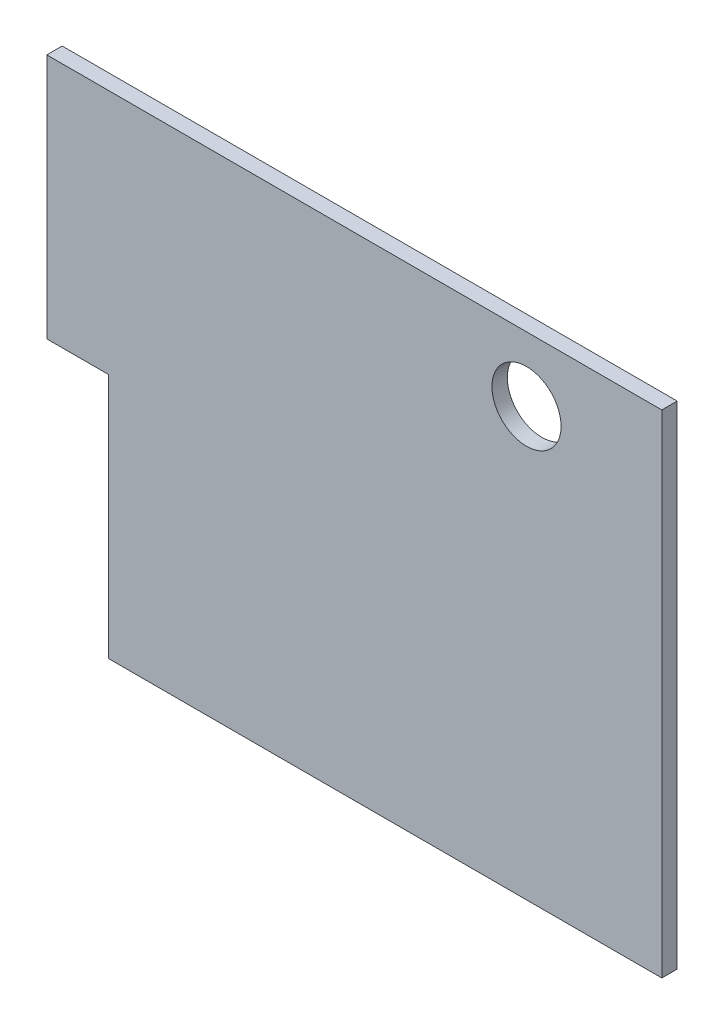
from build123d import *

# Parameters (mm, degrees)
SKETCH1_W           = 254
SKETCH1_H           = 203.2
BOSS_EXTRUDE1_DEPTH = 6.35
SKETCH2_R           = 14.2748
SKETCH2_W           = 25.4
SKETCH2_H           = 101.6
CUT_EXTRUDE1_DEPTH  = 163.763271348


with BuildPart() as part:
    # Sketch1 → Boss-Extrude1 (new body)
    with BuildSketch(Plane.XY):
        Rectangle(SKETCH1_W, SKETCH1_H)
    extrude(amount=BOSS_EXTRUDE1_DEPTH)

    # Sketch2 → Cut-Extrude1 (cut, through all)
    with BuildSketch(Plane.XY.offset(6.35)):
        with Locations((71.12, 74.93)):
            Circle(SKETCH2_R)
        with Locations((-114.3, -50.8)):
            Rectangle(SKETCH2_W, SKETCH2_H)
    extrude(amount=-CUT_EXTRUDE1_DEPTH, mode=Mode.SUBTRACT)


solid = part.part
